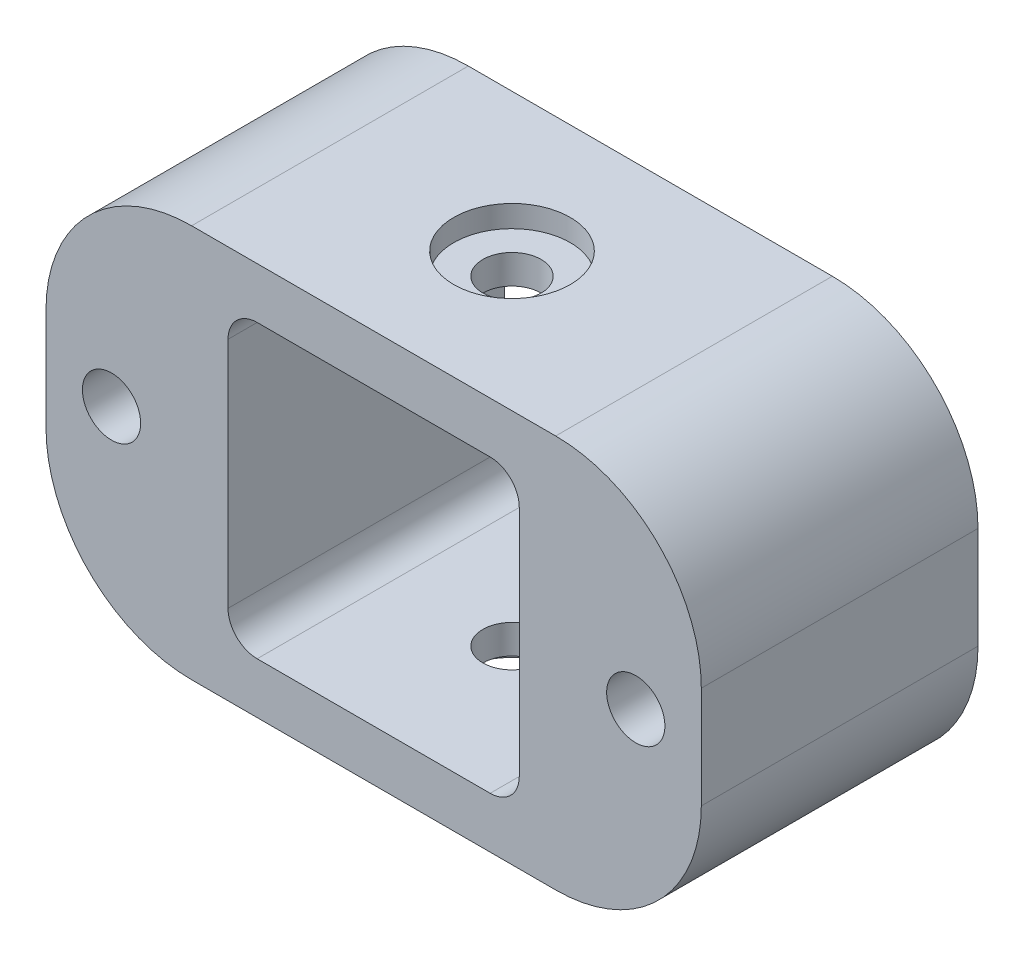
from build123d import *

# Parameters (mm, degrees)
SKETCH1_R           = 2
BOSS_EXTRUDE1_DEPTH = 19
SKETCH3_R           = 2
CUT_EXTRUDE2_DEPTH  = 40.953097502
SKETCH4_R           = 4
CUT_EXTRUDE3_DEPTH  = 1.5
CUT_EXTRUDE4_START  = -1.5
SKETCH5_R           = 4
CUT_EXTRUDE4_DEPTH  = 1.5


with BuildPart() as part:
    # Sketch1 → Boss-Extrude1 (new body)
    with BuildSketch(Plane.XY):
        with BuildLine():
            Line((-12.5, -13.5), (12.5, -13.5))
            ThreePointArc((12.5, -13.5), (19.571067812, -10.571067812), (22.5, -3.5))
            Line((22.5, -3.5), (22.5, 3.5))
            ThreePointArc((22.5, 3.5), (19.571067812, 10.571067812), (12.5, 13.5))
            Line((12.5, 13.5), (-12.5, 13.5))
            ThreePointArc((-12.5, 13.5), (-19.571067812, 10.571067812), (-22.5, 3.5))
            Line((-22.5, 3.5), (-22.5, -3.5))
            ThreePointArc((-22.5, -3.5), (-19.571067812, -10.571067812), (-12.5, -13.5))
        make_face()
        with Locations((-18, 0)):
            Circle(SKETCH1_R, mode=Mode.SUBTRACT)
        with Locations((18, 0)):
            Circle(SKETCH1_R, mode=Mode.SUBTRACT)
        with BuildLine():
            Line((-8, -10), (8, -10))
            ThreePointArc((8, -10), (9.414213562, -9.414213562), (10, -8))
            Line((10, -8), (10, 8))
            ThreePointArc((10, 8), (9.414213562, 9.414213562), (8, 10))
            Line((8, 10), (-8, 10))
            ThreePointArc((-8, 10), (-9.414213562, 9.414213562), (-10, 8))
            Line((-10, 8), (-10, -8))
            ThreePointArc((-10, -8), (-9.414213562, -9.414213562), (-8, -10))
        make_face(mode=Mode.SUBTRACT)
    extrude(amount=BOSS_EXTRUDE1_DEPTH)

    # Sketch3 → Cut-Extrude2 (cut, through all)
    with BuildSketch(Plane(origin=(0, 13.5, 0), x_dir=(1, 0, 0), z_dir=(0, 1, 0))):
        with Locations(Location((0, -9.5, 0), (0, 0, 270))):
            Circle(SKETCH3_R)
    extrude(amount=-CUT_EXTRUDE2_DEPTH, mode=Mode.SUBTRACT)

    # Sketch4 → Cut-Extrude3 (cut)
    with BuildSketch(Plane(origin=(0, 13.5, 0), x_dir=(1, 0, 0), z_dir=(0, 1, 0))):
        with Locations(Location((0, -9.5, 0), (0, 0, 270))):
            Circle(SKETCH4_R)
    extrude(amount=-CUT_EXTRUDE3_DEPTH, mode=Mode.SUBTRACT)

    # Sketch5 → Cut-Extrude4 (cut)
    with BuildSketch(Plane.XZ.offset(13.5).offset(CUT_EXTRUDE4_START)):
        with Locations(Location((0, 9.5, 0), (0, 0, 90))):
            Circle(SKETCH5_R)
    extrude(amount=CUT_EXTRUDE4_DEPTH, mode=Mode.SUBTRACT)


solid = part.part
